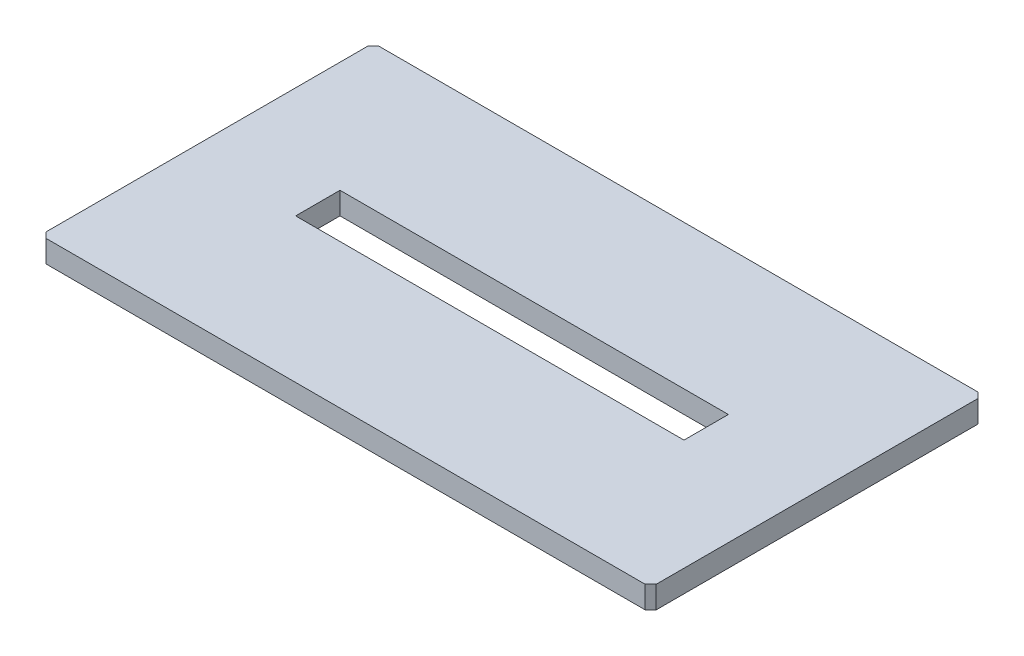
from build123d import *

# Parameters (mm, degrees)
SKETCH_1_W          = 550
SKETCH_1_H          = 300
SKETCH_1_W_2        = 350
SKETCH_1_H_2        = 40
EXTRUDE_1_DEPTH     = 20
CHAMFER_1_SIZE      = 5
SKETCH_2_R          = 5
CUT_EXTRUDE_1_DEPTH = 17


with BuildPart() as part:
    # Эскиз1 → Бобышка-Вытянуть1 (new body)
    with BuildSketch(Plane(origin=(0, 0, 0), x_dir=(1, 0, 0), z_dir=(0, 1, 0))):
        Rectangle(SKETCH_1_W, SKETCH_1_H)
        Rectangle(SKETCH_1_W_2, SKETCH_1_H_2, mode=Mode.SUBTRACT)
    extrude(amount=-EXTRUDE_1_DEPTH)

    # Фаска1
    chamfer_1_edges = [part.edges().sort_by_distance(p)[0] for p in [
        (275, -10, 150),
        (-275, -10, 150),
        (-275, -10, -150),
        (275, -10, -150),
    ]]
    chamfer(chamfer_1_edges, length=CHAMFER_1_SIZE)

    # Эскиз2 → Вырез-Вытянуть1 (cut)
    with BuildSketch(Plane(origin=(0, -20, 0), x_dir=(-1, 0, 0), z_dir=(0, 1, 0))):
        with Locations(Location((240, 115, 0), (0, 0, 270))):
            Circle(SKETCH_2_R)
        with Locations(Location((-240, 115, 0), (0, 0, 270))):
            Circle(SKETCH_2_R)
        with Locations(Location((-240, -115, 0), (0, 0, 270))):
            Circle(SKETCH_2_R)
        with Locations(Location((240, -115, 0), (0, 0, 270))):
            Circle(SKETCH_2_R)
    extrude(amount=CUT_EXTRUDE_1_DEPTH, mode=Mode.SUBTRACT)


solid = part.part
